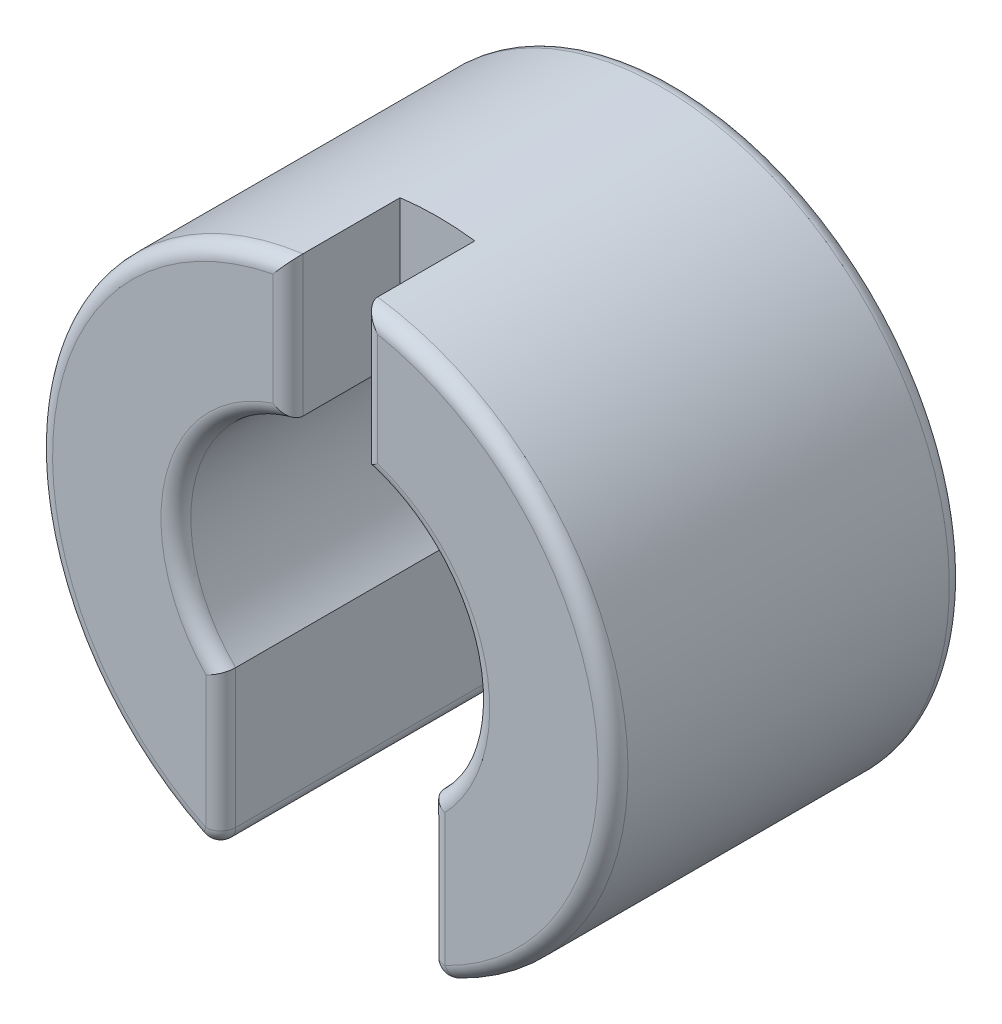
from build123d import *

# Parameters (mm, degrees)
EXTRUDE_1_DEPTH     = 4.7
CUT_EXTRUDE_START   = -1.5
CUT_EXTRUDE_1_DEPTH = 1.5
CUT_EXTRUDE_2_DEPTH = 1.5
CUT_EXTRUDE_3_DEPTH = 8.192704637
FILLET_1_R          = 0.2


with BuildPart() as part:
    # 草图1 → 凸台-拉伸1 (new body)
    with BuildSketch(Plane.XY):
        with BuildLine():
            Line((-1.4, -3.586432768), (-1.4, -1.428285686))
            ThreePointArc((-1.4, -1.428285686), (0, 2), (1.4, -1.428285686))
            Line((1.4, -1.428285686), (1.4, -3.586432768))
            ThreePointArc((1.4, -3.586432768), (0, 3.85), (-1.4, -3.586432768))
        make_face()
    extrude(amount=EXTRUDE_1_DEPTH)

    # 草图2 → 切除-拉伸1 (cut)
    with BuildSketch(Plane.XY.offset(4.7).offset(CUT_EXTRUDE_START)):
        with BuildLine():
            Line((-0.5, 1.936491673), (-0.5, 3.817394399))
            ThreePointArc((-0.5, 3.817394399), (0, 3.85), (0.5, 3.817394399))
            Line((0.5, 3.817394399), (0.5, 1.936491673))
            ThreePointArc((0.5, 1.936491673), (0, 2), (-0.5, 1.936491673))
        make_face()
    extrude(amount=CUT_EXTRUDE_1_DEPTH, mode=Mode.SUBTRACT)

    # 草图3 → 切除-拉伸2 (cut)
    with BuildSketch(Plane(origin=(0, 0, 0), x_dir=(-1, 0, 0), z_dir=(0, 0, -1))):
        with BuildLine():
            Line((-1.767766953, -1.767766953), (-2.474873734, -2.474873734))
            ThreePointArc((-2.474873734, -2.474873734), (0, 3.5), (2.474873734, -2.474873734))
            Line((2.474873734, -2.474873734), (1.767766953, -1.767766953))
            ThreePointArc((1.767766953, -1.767766953), (0, 2.5), (-1.767766953, -1.767766953))
        make_face()
    extrude(amount=-CUT_EXTRUDE_2_DEPTH, mode=Mode.SUBTRACT)

    # 草图4 → 切除-拉伸3 (cut, through all)
    with BuildSketch(Plane(origin=(0, 0, 0), x_dir=(-1, 0, 0), z_dir=(0, 0, -1))):
        with BuildLine():
            Line((-0.5, 1.936491673), (-0.5, 2.244994432))
            ThreePointArc((-0.5, 2.244994432), (0, 2.3), (0.5, 2.244994432))
            Line((0.5, 2.244994432), (0.5, 1.936491673))
            ThreePointArc((0.5, 1.936491673), (0, 2), (-0.5, 1.936491673))
        make_face()
    extrude(amount=-CUT_EXTRUDE_3_DEPTH, mode=Mode.SUBTRACT)

    # 圆角1
    fillet_1_edges = [part.edges().sort_by_distance(p)[0] for p in [
        (-1.932079623, 0.516786543, 4.7),
        (1.4, -2.507359227, 4.7),
        (-3.821866583, 0.464581337, 4.7),
        (1.932079623, 0.516786543, 4.7),
        (0.5, 2.876943036, 4.7),
        (-0.5, 2.876943036, 4.7),
        (3.821866583, 0.464581337, 4.7),
        (0, 3.85, 0),
        (-1.4, -2.507359227, 4.7),
        (1.4, -3.586432768, 2.35),
        (-1.4, -3.586432768, 2.35),
    ]]
    fillet(fillet_1_edges, radius=FILLET_1_R)


solid = part.part
